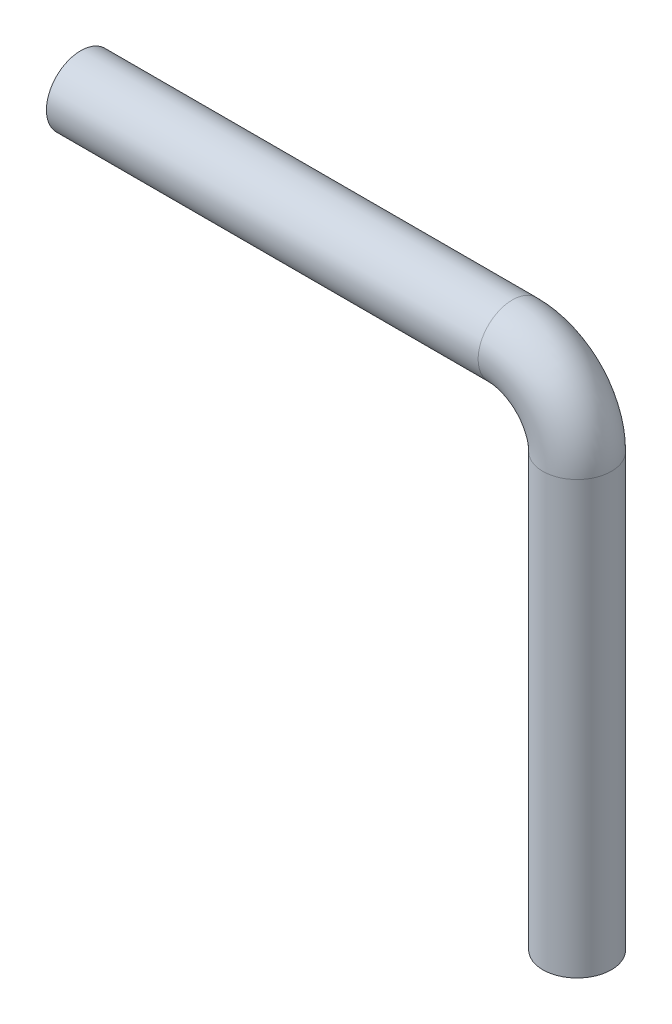
from build123d import *

# Parameters (mm, degrees)
TUBE_PROFILE_R   = 3.175
TUBE_PROFILE_R_2 = 2.175


with BuildPart() as part:
    # Tube: sweep along a curve in space
    with BuildLine() as tube_path:
        Line((134, 234, 50), (174, 234, 50))
        ThreePointArc((180, 228, 50), (178.242640687, 232.242640687, 50), (174, 234, 50))
        Line((180, 228, 50), (180, 188, 50))
    # Tube profile (on start of the path) → Tube (sweep)
    with BuildSketch(Plane(origin=(134, 234, 50), x_dir=(0, 0, 1), z_dir=(1, 0, 0))):
        Circle(TUBE_PROFILE_R)
        Circle(TUBE_PROFILE_R_2, mode=Mode.SUBTRACT)
    sweep(path=tube_path.line)


solid = part.part
